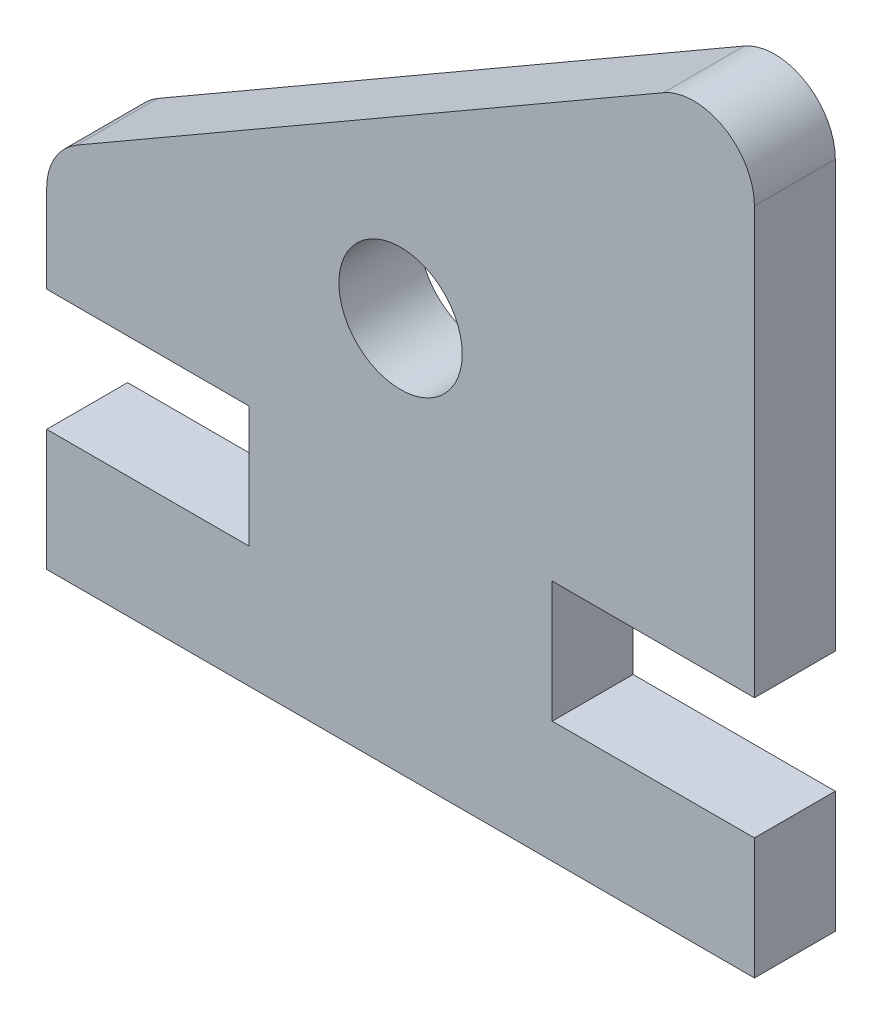
from build123d import *

# Parameters (mm, degrees)
ESBO_O1_R                = 3.05
RESSALTO_EXTRUS_O1_DEPTH = 4
FILETE1_R                = 3


with BuildPart() as part:
    # Esboço1 → Ressalto-extrusão1 (new body)
    with BuildSketch(Plane.XY):
        Polygon((0, 38.263883749), (-35, 18.056624327), (-35, 12), (-25, 12), (-25, 6), (-35, 6), (-35, 0), (0, 0), (0, 6), (-10, 6), (-10, 12), (0, 12), align=None)
        with Locations((-17.5, 19.5)):
            Circle(ESBO_O1_R, mode=Mode.SUBTRACT)
    extrude(amount=RESSALTO_EXTRUS_O1_DEPTH)

    # Filete1
    filete1_edges = [part.edges().sort_by_distance(p)[0] for p in [
        (-35, 18.056624327, 2),
        (0, 38.263883749, 2),
    ]]
    fillet(filete1_edges, radius=FILETE1_R)


solid = part.part
